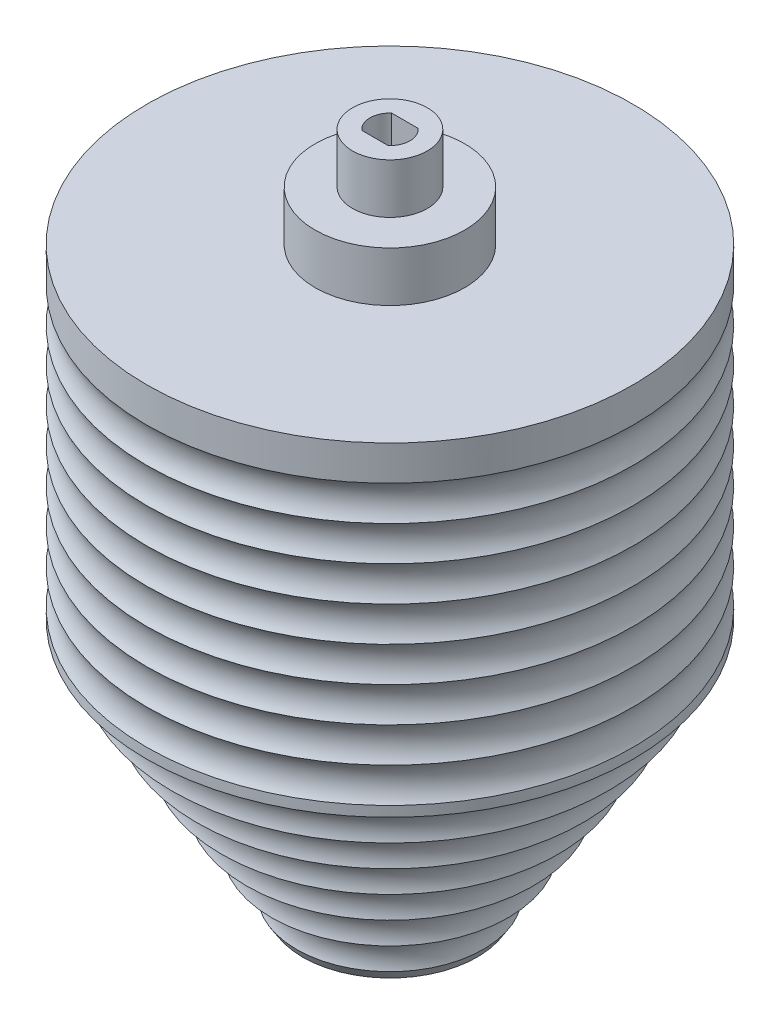
from build123d import *

# Parameters (mm, degrees)
SKETCH3_R           = 12.5
SKETCH4_R           = 12.5
SKETCH5_R           = 40
BOSS_EXTRUDE1_DEPTH = 22
SKETCH6_R           = 2.5
CUT_EXTRUDE1_DEPTH  = 15
SKETCH9_R           = 30
BOSS_EXTRUDE3_DEPTH = 20
SKETCH8_R           = 15
BOSS_EXTRUDE4_DEPTH = 20
CUT_EXTRUDE2_START  = -3
SKETCH10_R          = 8
CUT_EXTRUDE2_DEPTH  = 3


with BuildPart() as part:
    # Sketch2 → Revolve1 (revolve)
    with BuildSketch(Plane.XY, mode=Mode.PRIVATE) as revolve1_sk:
        Polygon((0, 45.229492814), (-200, 45.229492814), (-200, -104.770507186), (-137.5, -204.770507186), (-117.5, -204.770507186), (-180, -104.770507186), (-180, 25.229492814), (-97.5, 25.229492814), (-97.5, -104.770507186), (-35, -204.770507186), (0, -204.770507186), (0, 25.229492814), align=None)
    revolve(revolve1_sk.sketch.rotate(Axis((0, 57.349299688, 0), (0, -1, 0)), 270), axis=Axis((0, 57.349299688, 0), (0, -1, 0)))

    # Sketch3 → Cut-Revolve1 (revolve, cut)
    with BuildSketch(Plane.XY, mode=Mode.PRIVATE) as cut_revolve1_sk:
        with Locations((-107.86084091, 4.25029405)):
            Circle(SKETCH3_R)
        with Locations((-107.86084091, -9.735838459)):
            Circle(SKETCH3_R)
        with Locations((-107.86084091, -23.721970968)):
            Circle(SKETCH3_R)
        with Locations((-107.86084091, -37.708103477)):
            Circle(SKETCH3_R)
        with Locations((-107.86084091, -51.694235986)):
            Circle(SKETCH3_R)
        with Locations((-107.86084091, -65.680368495)):
            Circle(SKETCH3_R)
        with Locations((-107.86084091, -79.666501004)):
            Circle(SKETCH3_R)
        with Locations((-107.86084091, -93.652633513)):
            Circle(SKETCH3_R)
    revolve(cut_revolve1_sk.sketch.rotate(Axis((0, 80.728496273, 0), (0, -1, 0)), 270), axis=Axis((0, 80.728496273, 0), (0, -1, 0)), mode=Mode.SUBTRACT)

    # Sketch4 → Cut-Revolve2 (revolve, cut)
    with BuildSketch(Plane.XY, mode=Mode.PRIVATE) as cut_revolve2_sk:
        with Locations((-89.441475281, -133.126338415)):
            Circle(SKETCH4_R)
        with Locations((-99.446691515, -117.117992442)):
            Circle(SKETCH4_R)
        with Locations((-79.436259048, -149.134684389)):
            Circle(SKETCH4_R)
        with Locations((-69.431042815, -165.143030362)):
            Circle(SKETCH4_R)
        with Locations((-59.425826582, -181.151376335)):
            Circle(SKETCH4_R)
        with Locations((-49.420610349, -197.159722308)):
            Circle(SKETCH4_R)
    revolve(cut_revolve2_sk.sketch.rotate(Axis((0, 86.064622477, 0), (0, -1, 0)), 270), axis=Axis((0, 86.064622477, 0), (0, -1, 0)), mode=Mode.SUBTRACT)

    # Sketch5 → Boss-Extrude1 (add)
    with BuildSketch(Plane(origin=(0, 45.229492814, 0), x_dir=(1, 0, 0), z_dir=(0, 1, 0))):
        with Locations(Location((0, 0, 0), (0, 0, 270))):
            Circle(SKETCH5_R)
        with BuildLine():
            Line((-5.522648203, 5.787949277), (5.05222187, 6.202826306))
            ThreePointArc((5.05222187, 6.202826306), (7.993850388, 0.313617555), (5.522648203, -5.787949277))
            Line((5.522648203, -5.787949277), (-5.05222187, -6.202826306))
            ThreePointArc((-5.05222187, -6.202826306), (-7.993850388, -0.313617555), (-5.522648203, 5.787949277))
        make_face(mode=Mode.SUBTRACT)
    extrude(amount=BOSS_EXTRUDE1_DEPTH)

    # Sketch6 → Cut-Extrude1 (cut)
    with BuildSketch(Plane(origin=(0, 67.229492814, 0), x_dir=(1, 0, 0), z_dir=(0, 1, 0))):
        with Locations(Location((0, 25, 0), (0, 0, 270))):
            Circle(SKETCH6_R)
        with Locations(Location((21.650635095, 12.5, 0), (0, 0, 270))):
            Circle(SKETCH6_R)
        with Locations(Location((21.650635095, -12.5, 0), (0, 0, 270))):
            Circle(SKETCH6_R)
        with Locations(Location((0, -25, 0), (0, 0, 270))):
            Circle(SKETCH6_R)
        with Locations(Location((-21.650635095, -12.5, 0), (0, 0, 270))):
            Circle(SKETCH6_R)
        with Locations(Location((-21.650635095, 12.5, 0), (0, 0, 270))):
            Circle(SKETCH6_R)
    extrude(amount=-CUT_EXTRUDE1_DEPTH, mode=Mode.SUBTRACT)

    # Sketch7 → Cut-Revolve3 (revolve, cut)
    with BuildSketch(Plane.XY, mode=Mode.PRIVATE) as cut_revolve3_sk:
        Polygon((0, 25.229492814), (125.171972737, 25.229492814), (125.171972737, -129.078798309), (44.932535507, -243.529943643), (312.748215589, -243.529943643), (312.748215589, 128.436278693), (0, 128.436278693), align=None)
    revolve(cut_revolve3_sk.sketch.rotate(Axis((0, 169.909572241, 0), (0, -1, 0)), 90), axis=Axis((0, 169.909572241, 0), (0, -1, 0)), mode=Mode.SUBTRACT)

    # Sketch9 → Boss-Extrude3 (add)
    with BuildSketch(Plane(origin=(0, 25.229492814, 0), x_dir=(1, 0, 0), z_dir=(0, 1, 0))):
        with Locations(Location((0, 0, 0), (0, 0, 270))):
            Circle(SKETCH9_R)
    extrude(amount=BOSS_EXTRUDE3_DEPTH)

    # Sketch8 → Boss-Extrude4 (add)
    with BuildSketch(Plane(origin=(0, 45.229492814, 0), x_dir=(1, 0, 0), z_dir=(0, 1, 0))):
        with Locations(Location((0, 0, 0), (0, 0, 270))):
            Circle(SKETCH8_R)
        with BuildLine():
            Line((-5.291502622, 6), (5.291502622, 6))
            ThreePointArc((5.291502622, 6), (8, 0), (5.291502622, -6))
            Line((5.291502622, -6), (-5.291502622, -6))
            ThreePointArc((-5.291502622, -6), (-8, 0), (-5.291502622, 6))
        make_face(mode=Mode.SUBTRACT)
    extrude(amount=BOSS_EXTRUDE4_DEPTH)

    # Sketch10 → Cut-Extrude2 (cut)
    with BuildSketch(Plane(origin=(0, 45.229492814, 0), x_dir=(1, 0, 0), z_dir=(0, 1, 0)).offset(CUT_EXTRUDE2_START)):
        with Locations(Location((0, 0, 0), (0, 0, 131.409622109))):
            Circle(SKETCH10_R)
    extrude(amount=CUT_EXTRUDE2_DEPTH, mode=Mode.SUBTRACT)


solid = part.part
